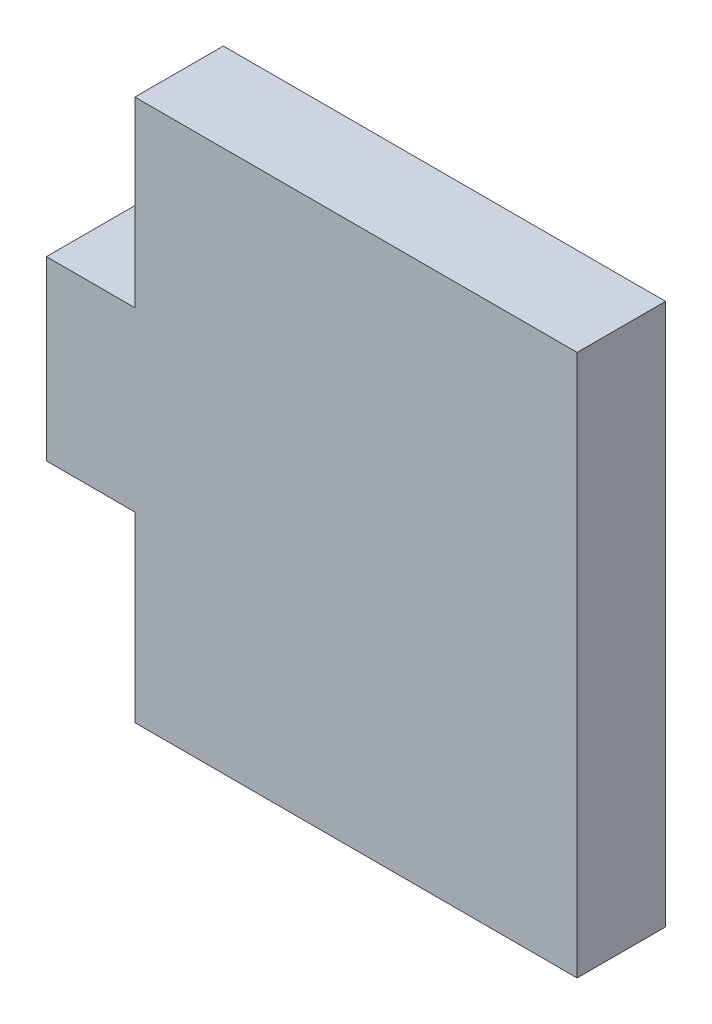
from build123d import *

# Parameters (mm, degrees)
SALIENTE_EXTRUIR1_DEPTH = 4


with BuildPart() as part:
    # Croquis1 → Saliente-Extruir1 (new body)
    with BuildSketch(Plane.XY):
        Polygon((12, 12.25), (-8, 12.25), (-8, 4), (-12, 4), (-12, -4), (-8, -4), (-8, -12.25), (12, -12.25), align=None)
    extrude(amount=SALIENTE_EXTRUIR1_DEPTH)


solid = part.part
